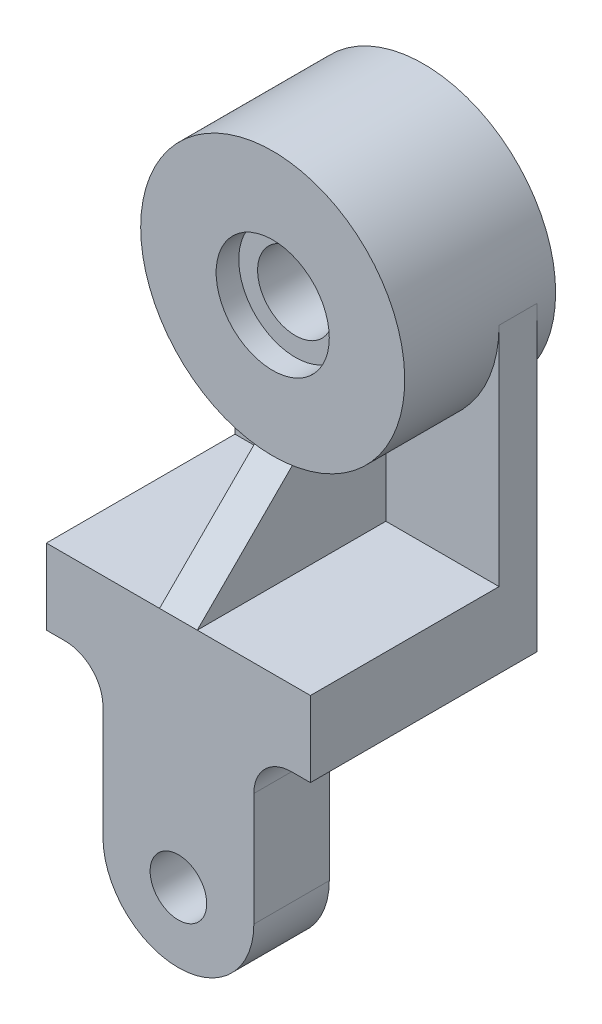
from build123d import *

# Parameters (mm, degrees)
SKETCH1_W                = 1778
SKETCH1_H                = 1524
BOSS_EXTRUDE1_DEPTH      = 508
SKETCH2_W                = 1778
SKETCH2_H                = 254
BOSS_EXTRUDE2_DEPTH      = 1524
BOSS_EXTRUDE3_DEPTH      = 508
FILLET1_R                = 254
SKETCH4_R                = 190.5
CUT_EXTRUDE1_DEPTH       = 508
BOSS_EXTRUDE4_DEPTH      = 127
BOSS_EXTRUDE4_DEPTH_BACK = 889
SKETCH5_R                = 889
SKETCH6_R                = 254
CUT_EXTRUDE2_DEPTH       = 3218.890302667
SKETCH7_R                = 381
CUT_EXTRUDE3_DEPTH       = 152.4
RIB1_REACH               = 3182.076
SKETCH8_WALL_W           = 7260.177497086
SKETCH8_WALL_H           = 254


with BuildPart() as part:
    # Sketch1 → Boss-Extrude1 (new body)
    with BuildSketch(Plane(origin=(0, 0, 0), x_dir=(1, 0, 0), z_dir=(0, 1, 0))):
        Rectangle(SKETCH1_W, SKETCH1_H)
    extrude(amount=BOSS_EXTRUDE1_DEPTH)

    # Sketch2 → Boss-Extrude2 (add)
    with BuildSketch(Plane(origin=(0, 508, 0), x_dir=(1, 0, 0), z_dir=(0, 1, 0))):
        with Locations((0, 635)):
            Rectangle(SKETCH2_W, SKETCH2_H)
    extrude(amount=BOSS_EXTRUDE2_DEPTH)

    # Sketch3 → Boss-Extrude3 (add)
    with BuildSketch(Plane.XY.offset(762)):
        with BuildLine():
            Line((-508, -1016), (-508, 0))
            Line((-508, 0), (508, 0))
            Line((508, 0), (508, -1016))
            ThreePointArc((508, -1016), (0, -1524), (-508, -1016))
        make_face()
    extrude(amount=-BOSS_EXTRUDE3_DEPTH)

    # Fillet1
    fillet1_edges = [part.edges().sort_by_distance(p)[0] for p in [
        (-508, 0, 508),
        (508, 0, 508),
    ]]
    fillet(fillet1_edges, radius=FILLET1_R)

    # Sketch4 → Cut-Extrude1 (cut)
    with BuildSketch(Plane.XY.offset(762)):
        with Locations((0, -1055.220310031)):
            Circle(SKETCH4_R)
    extrude(amount=-CUT_EXTRUDE1_DEPTH, mode=Mode.SUBTRACT)

    # Sketch5 → Boss-Extrude4 (add, two sides: drawn at the far end of the back side and taken through both)
    with BuildSketch(Plane(origin=(0, 0, -762), x_dir=(-1, 0, 0), z_dir=(0, 0, -1)).offset(-BOSS_EXTRUDE4_DEPTH_BACK)):
        with Locations((0, 2032)):
            Circle(SKETCH5_R)
    extrude(amount=BOSS_EXTRUDE4_DEPTH + BOSS_EXTRUDE4_DEPTH_BACK)

    # Sketch6 → Cut-Extrude2 (cut, through all)
    with BuildSketch(Plane.XY.offset(127)):
        with Locations((0, 2022.259631079)):
            Circle(SKETCH6_R)
    extrude(amount=-CUT_EXTRUDE2_DEPTH, mode=Mode.SUBTRACT)

    # Sketch7 → Cut-Extrude3 (cut)
    with BuildSketch(Plane.XY.offset(127)):
        with Locations((0, 2022.259631079)):
            Circle(SKETCH7_R)
    cut_extrude3 = extrude(amount=-CUT_EXTRUDE3_DEPTH, mode=Mode.SUBTRACT)

    # Mirror1: Cut-Extrude3 across plane
    add(cut_extrude3.mirror(Plane.XY.offset(-381)), mode=Mode.SUBTRACT)

    # Sketch8 wall → Rib1 (add, up to next)
    with BuildSketch(Plane(origin=(0, 825.5, 444.5), x_dir=(0, -0.707106781187, 0.707106781187), z_dir=(0, -0.707106781187, -0.707106781187)), mode=Mode.PRIVATE) as rib1_sk1:
        Rectangle(SKETCH8_WALL_W, SKETCH8_WALL_H)
    rib1_tool1 = extrude(rib1_sk1.sketch, amount=RIB1_REACH, mode=Mode.PRIVATE) - part.part
    add(rib1_tool1.solids().sort_by_distance((0, 825.5, 444.5))[0])


solid = part.part
